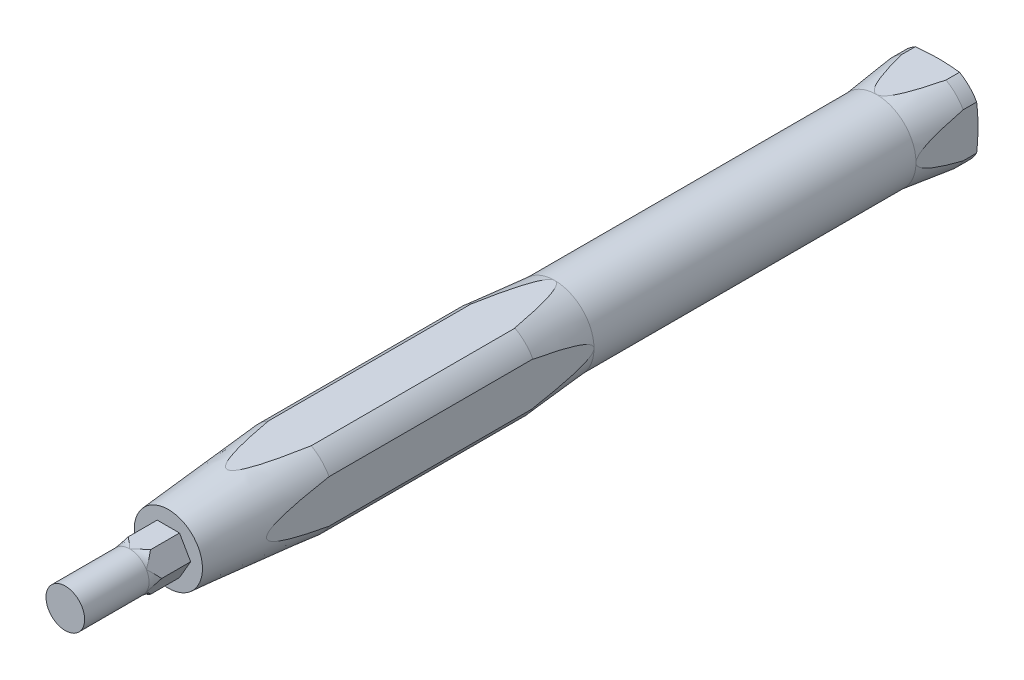
from build123d import *

# Parameters (mm, degrees)
SKETCH1_W           = 12.2
SKETCH1_H           = 12.2
BOSS_EXTRUDE1_DEPTH = 120
SKETCH2_OUTSIDE_W   = 38.446
SKETCH2_OUTSIDE_H   = 38.446
SKETCH2_OUTSIDE_R   = 6.95
CUT_EXTRUDE1_DEPTH  = 121.309683733
SKETCH3_OUTSIDE_W   = 41.946
SKETCH3_OUTSIDE_H   = 41.946
SKETCH3_OUTSIDE_R   = 5.3
CUT_EXTRUDE2_DEPTH  = 20
CUT_EXTRUDE2_DRAFT  = -5
CUT_EXTRUDE3_START  = -60
SKETCH4_OUTSIDE_W   = 38.446
SKETCH4_OUTSIDE_H   = 38.446
SKETCH4_OUTSIDE_R   = 6.1
CUT_EXTRUDE3_DEPTH  = 50
SKETCH5_OUTSIDE_W   = 40.11
SKETCH5_OUTSIDE_H   = 40.11
SKETCH5_OUTSIDE_R   = 6.1
CUT_EXTRUDE4_DEPTH  = 9.5
CUT_EXTRUDE4_DRAFT  = -5
BOSS_EXTRUDE2_DEPTH = 3.5
SKETCH6_OUTSIDE_W   = 40.78
SKETCH6_OUTSIDE_H   = 40.78
SKETCH6_OUTSIDE_R   = 6.1
CUT_EXTRUDE6_DEPTH  = 9.5
CUT_EXTRUDE6_DRAFT  = -7
SKETCH8_OUTSIDE_W   = 68.768
SKETCH8_OUTSIDE_H   = 68.768
SKETCH8_OUTSIDE_R   = 4.5
CUT_EXTRUDE7_DEPTH  = 3.5
CUT_EXTRUDE7_DRAFT  = -77
BOSS_EXTRUDE3_DEPTH = 16


with BuildPart() as part:
    # Sketch1 → Boss-Extrude1 (new body)
    with BuildSketch(Plane.XY):
        Rectangle(SKETCH1_W, SKETCH1_H)
    extrude(amount=BOSS_EXTRUDE1_DEPTH)

    # Sketch2 outside → Cut-Extrude1 (cut, through all)
    with BuildSketch(Plane.XY.offset(120)):
        Rectangle(SKETCH2_OUTSIDE_W, SKETCH2_OUTSIDE_H)
        Circle(SKETCH2_OUTSIDE_R, mode=Mode.SUBTRACT)
    extrude(amount=-CUT_EXTRUDE1_DEPTH, mode=Mode.SUBTRACT)


with BuildPart() as cut_extrude2_tool:
    # Sketch3 outside → Cut-Extrude2 (with draft: the straight prism first)
    with BuildSketch(Plane.XY.offset(120)):
        Rectangle(SKETCH3_OUTSIDE_W, SKETCH3_OUTSIDE_H)
        Circle(SKETCH3_OUTSIDE_R, mode=Mode.SUBTRACT)
    extrude(amount=-CUT_EXTRUDE2_DEPTH)
    # Cut-Extrude2: the draft: its side faces are tilted about the plane it starts from
    cut_extrude2_sides = [cut_extrude2_tool.faces().sort_by_distance(p)[0] for p in [
        (0, -20.973, 110),
        (20.973, 0, 110),
        (0, 20.973, 110),
        (-20.973, 0, 110),
        (-5.3, 0, 110),
    ]]
    draft(cut_extrude2_sides, Plane.XY.offset(120), CUT_EXTRUDE2_DRAFT)


with BuildPart() as part_1:
    add(part.part)

    # Cut-Extrude2: cut by cut_extrude2_tool
    add(cut_extrude2_tool.part, mode=Mode.SUBTRACT)

    # Sketch4 outside → Cut-Extrude3 (cut)
    with BuildSketch(Plane.XY.offset(120).offset(CUT_EXTRUDE3_START)):
        Rectangle(SKETCH4_OUTSIDE_W, SKETCH4_OUTSIDE_H)
        Circle(SKETCH4_OUTSIDE_R, mode=Mode.SUBTRACT)
    extrude(amount=-CUT_EXTRUDE3_DEPTH, mode=Mode.SUBTRACT)


with BuildPart() as cut_extrude4_tool:
    # Sketch5 outside → Cut-Extrude4 (with draft: the straight prism first)
    with BuildSketch(Plane(origin=(0, 0, 60), x_dir=(-1, 0, 0), z_dir=(0, 0, -1))):
        Rectangle(SKETCH5_OUTSIDE_W, SKETCH5_OUTSIDE_H)
        with Locations(Location((0, 0, 0), (0, 0, 180))):
            Circle(SKETCH5_OUTSIDE_R, mode=Mode.SUBTRACT)
    extrude(amount=-CUT_EXTRUDE4_DEPTH)
    # Cut-Extrude4: the draft: its side faces are tilted about the plane it starts from
    cut_extrude4_sides = [cut_extrude4_tool.faces().sort_by_distance(p)[0] for p in [
        (0, -20.055, 64.75),
        (-20.055, 0, 64.75),
        (0, 20.055, 64.75),
        (20.055, 0, 64.75),
        (-6.1, 0, 64.75),
    ]]
    draft(cut_extrude4_sides, Plane(origin=(0, 0, 60), x_dir=(-1, 0, 0), z_dir=(0, 0, -1)), CUT_EXTRUDE4_DRAFT)


with BuildPart() as part_2:
    add(part_1.part)

    # Cut-Extrude4: cut by cut_extrude4_tool
    add(cut_extrude4_tool.part, mode=Mode.SUBTRACT)

    # Sketch7 → Boss-Extrude2 (add)
    with BuildSketch(Plane(origin=(0, 0, 0), x_dir=(-1, 0, 0), z_dir=(0, 0, -1))):
        with BuildLine():
            Line((3.433656943, -6.1), (-3.433656943, -6.1))
            ThreePointArc((-3.433656943, -6.1), (-4.949747468, -4.949747468), (-6.1, -3.433656943))
            Line((-6.1, -3.433656943), (-6.1, 3.433656943))
            ThreePointArc((-6.1, 3.433656943), (-4.949747468, 4.949747468), (-3.433656943, 6.1))
            Line((-3.433656943, 6.1), (3.433656943, 6.1))
            ThreePointArc((3.433656943, 6.1), (4.949747468, 4.949747468), (6.1, 3.433656943))
            Line((6.1, 3.433656943), (6.1, -3.433656943))
            ThreePointArc((6.1, -3.433656943), (4.949747468, -4.949747468), (3.433656943, -6.1))
        make_face()
    extrude(amount=-BOSS_EXTRUDE2_DEPTH)


with BuildPart() as cut_extrude6_tool:
    # Sketch6 outside → Cut-Extrude6 (with draft: the straight prism first)
    with BuildSketch(Plane.XY.offset(10)):
        Rectangle(SKETCH6_OUTSIDE_W, SKETCH6_OUTSIDE_H)
        Circle(SKETCH6_OUTSIDE_R, mode=Mode.SUBTRACT)
    extrude(amount=-CUT_EXTRUDE6_DEPTH)
    # Cut-Extrude6: the draft: its side faces are tilted about the plane it starts from
    cut_extrude6_sides = [cut_extrude6_tool.faces().sort_by_distance(p)[0] for p in [
        (0, -20.39, 5.25),
        (20.39, 0, 5.25),
        (0, 20.39, 5.25),
        (-20.39, 0, 5.25),
        (-6.1, 0, 5.25),
    ]]
    draft(cut_extrude6_sides, Plane.XY.offset(10), CUT_EXTRUDE6_DRAFT)


with BuildPart() as part_3:
    add(part_2.part)

    # Cut-Extrude6: cut by cut_extrude6_tool
    add(cut_extrude6_tool.part, mode=Mode.SUBTRACT)


with BuildPart() as cut_extrude7_tool:
    # Sketch8 outside → Cut-Extrude7 (with draft: the straight prism first)
    with BuildSketch(Plane(origin=(0, 0, 0), x_dir=(-1, 0, 0), z_dir=(0, 0, -1))):
        Rectangle(SKETCH8_OUTSIDE_W, SKETCH8_OUTSIDE_H)
        Circle(SKETCH8_OUTSIDE_R, mode=Mode.SUBTRACT)
    extrude(amount=-CUT_EXTRUDE7_DEPTH)
    # Cut-Extrude7: the draft: its side faces are tilted about the plane it starts from
    cut_extrude7_sides = [cut_extrude7_tool.faces().sort_by_distance(p)[0] for p in [
        (0, -34.384, 1.75),
        (-34.384, 0, 1.75),
        (0, 34.384, 1.75),
        (34.384, 0, 1.75),
        (4.5, 0, 1.75),
    ]]
    draft(cut_extrude7_sides, Plane(origin=(0, 0, 0), x_dir=(-1, 0, 0), z_dir=(0, 0, -1)), CUT_EXTRUDE7_DRAFT)


with BuildPart() as part_4:
    add(part_3.part)

    # Cut-Extrude7: cut by cut_extrude7_tool
    add(cut_extrude7_tool.part, mode=Mode.SUBTRACT)

    # Sketch9 → Boss-Extrude3 (add)
    with BuildSketch(Plane.XY.offset(120)):
        Polygon((1.732050808, 3), (-1.732050808, 3), (-3.464101615, 0), (-1.732050808, -3), (1.732050808, -3), (3.464101615, 0), align=None)
    extrude(amount=BOSS_EXTRUDE3_DEPTH)

    # Sketch10 → Cut-Revolve1 (revolve, cut)
    with BuildSketch(Plane(origin=(0, 0, 0), x_dir=(1, 0, 0), z_dir=(0, 1, 0))):
        with BuildLine():
            Line((3, -136), (3, -126))
            ThreePointArc((3, -126), (3.1186767, -125.214921929), (3.464101615, -124.5))
            Line((3.464101615, -124.5), (3.464101615, -136))
            Line((3.464101615, -136), (3, -136))
        make_face()
    revolve(axis=Axis((0, 0, 120), (0, 0, -1)), mode=Mode.SUBTRACT)


solid = part_4.part
